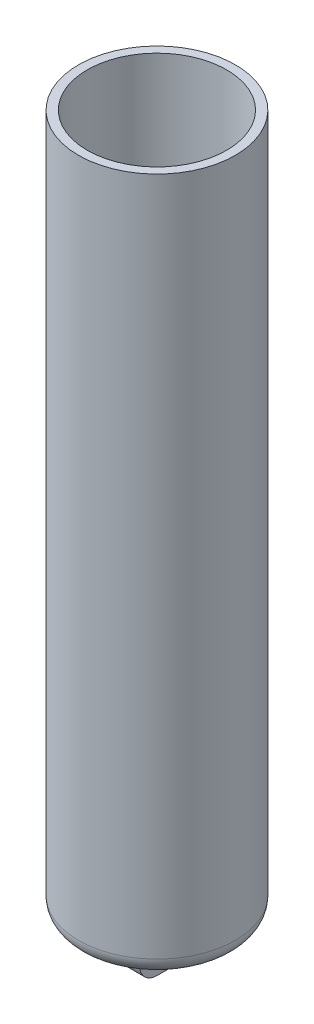
from build123d import *

# Parameters (mm, degrees)
SKETCH_1_R          = 9
EXTRUDE_1_DEPTH     = 80
SKETCH_2_R          = 8
CUT_EXTRUDE_1_DEPTH = 77
SKETCH_3_W          = 2
SKETCH_3_H          = 6
EXTRUDE_2_DEPTH     = 5
SKETCH_4_R          = 1.25
CUT_EXTRUDE_2_DEPTH = 5
FILLET_1_R          = 2
FILLET_2_R          = 2
FILLET_3_R          = 2


with BuildPart() as part:
    # 草图1 → 凸台-拉伸1 (new body)
    with BuildSketch(Plane(origin=(0, 0, 0), x_dir=(1, 0, 0), z_dir=(0, 1, 0))):
        with Locations(Location((0, 0, 0), (0, 0, 270))):
            Circle(SKETCH_1_R)
    extrude(amount=EXTRUDE_1_DEPTH)

    # 草图2 → 切除-拉伸1 (cut)
    with BuildSketch(Plane(origin=(0, 80, 0), x_dir=(1, 0, 0), z_dir=(0, 1, 0))):
        with Locations(Location((0, 0, 0), (0, 0, 270))):
            Circle(SKETCH_2_R)
    extrude(amount=-CUT_EXTRUDE_1_DEPTH, mode=Mode.SUBTRACT)

    # 草图3 → 凸台-拉伸2 (add)
    with BuildSketch(Plane(origin=(0, 0, 0), x_dir=(-1, 0, 0), z_dir=(0, -1, 0))):
        Rectangle(SKETCH_3_W, SKETCH_3_H)
    extrude(amount=EXTRUDE_2_DEPTH)

    # 草图4 → 切除-拉伸2 (cut)
    with BuildSketch(Plane(origin=(1, 0, 0), x_dir=(0, 0, -1), z_dir=(1, 0, 0))):
        with Locations((0, -2.515551663)):
            Circle(SKETCH_4_R)
    extrude(amount=-CUT_EXTRUDE_2_DEPTH, mode=Mode.SUBTRACT)

    # 圆角1
    fillet_1_edges = [part.edges().sort_by_distance(p)[0] for p in [
        (0, -5, -3),
    ]]
    fillet(fillet_1_edges, radius=FILLET_1_R)

    # 圆角2
    fillet_2_edges = [part.edges().sort_by_distance(p)[0] for p in [
        (0, -5, 3),
    ]]
    fillet(fillet_2_edges, radius=FILLET_2_R)

    # 圆角3
    fillet_3_edges = [part.edges().sort_by_distance(p)[0] for p in [
        (0, 0, -9),
    ]]
    fillet(fillet_3_edges, radius=FILLET_3_R)


solid = part.part
